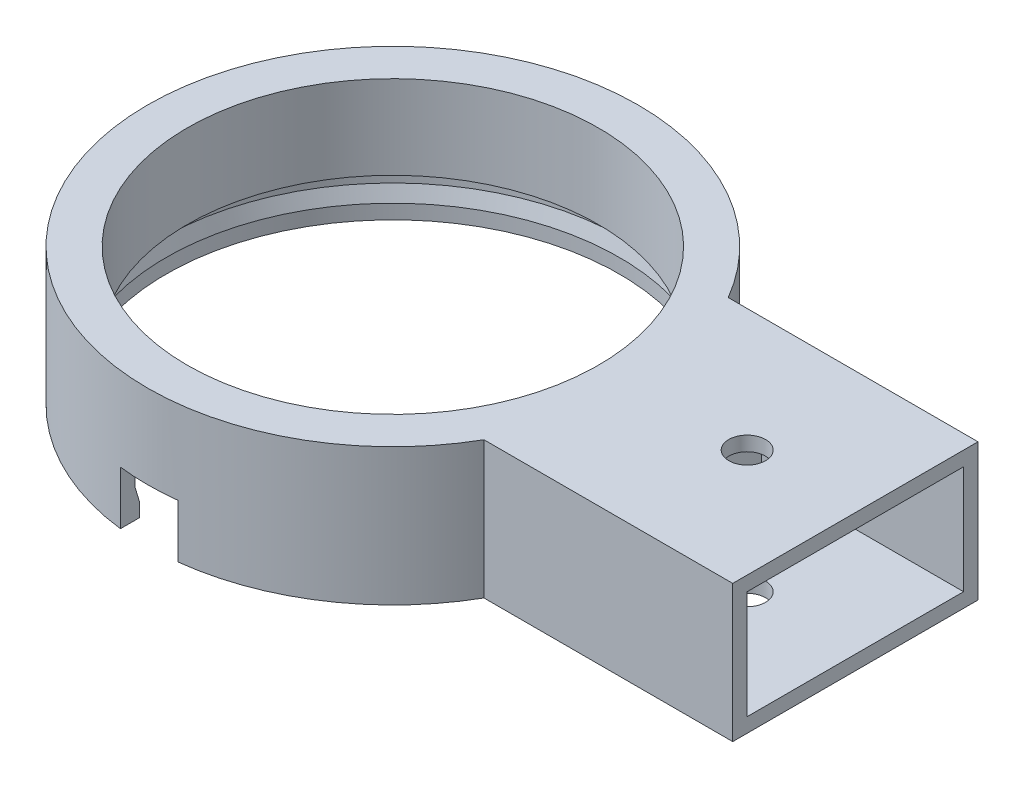
from build123d import *
from build123d.topology import SkipClean

# Parameters (mm, degrees)
SKETCH1_R                = 43.18
SKETCH1_R_2              = 38.1
SKETCH1_R_3              = 36.195
BOSS_EXTRUDE1_DEPTH      = 2.54
BOSS_EXTRUDE2_START      = 4.318
SKETCH2_R                = 43.18
SKETCH2_R_2              = 40.64
BOSS_EXTRUDE2_DEPTH      = 4.318
SKETCH7_W                = 5.08
SKETCH7_H                = 10.16
CUT_EXTRUDE1_DEPTH       = 12.7
SKETCH12_R               = 43.18
SKETCH12_R_2             = 36.195
BOSS_EXTRUDE3_DEPTH      = 12.192
BOSS_EXTRUDE4_REACH      = 99.671
BOSS_EXTRUDE4_END_RADIUS = 43.18
SKETCH13_W               = 43.18
SKETCH13_H               = 24.13
BOSS_EXTRUDE5_DEPTH      = 38.1
SKETCH14_W               = 38.1
SKETCH14_H               = 19.05
CUT_EXTRUDE2_DEPTH       = 35.56
SKETCH17_R               = 3.2385
CUT_EXTRUDE3_DEPTH       = 35.56


with BuildPart() as part:
    # Sketch1 → Boss-Extrude1 (new body)
    # profile 1 of 2: a face of its own
    with BuildSketch(Plane(origin=(0, 0, 0), x_dir=(1, 0, 0), z_dir=(0, 1, 0))):
        with Locations(Location((0, 0, 0), (0, 0, 270))):
            Circle(SKETCH1_R)
        Circle(SKETCH1_R_2, mode=Mode.SUBTRACT)
    # profile 2 of 2: a face of its own
    with BuildSketch(Plane(origin=(0, 0, 0), x_dir=(1, 0, 0), z_dir=(0, 1, 0))):
        Circle(SKETCH1_R_2)
        with Locations(Location((0, 0, 0), (0, 0, 270))):
            Circle(SKETCH1_R_3, mode=Mode.SUBTRACT)
    extrude(amount=BOSS_EXTRUDE1_DEPTH)

    # Sketch2 → Boss-Extrude2 (add)
    with BuildSketch(Plane.XZ.offset(BOSS_EXTRUDE2_START)):
        with Locations(Location((0, 0, 0), (0, 0, 270))):
            Circle(SKETCH2_R)
        with Locations(Location((0, 0, 0), (0, 0, 270))):
            Circle(SKETCH2_R_2, mode=Mode.SUBTRACT)
    extrude(amount=-BOSS_EXTRUDE2_DEPTH)

    # Sketch3 → Revolve1 (revolve)
    with BuildSketch(Plane.XY, mode=Mode.PRIVATE) as revolve1_sk:
        Polygon((-40.64, -4.318), (-43.18, -4.318), (-43.18, -9.398), (-39.878, -9.398), (-39.878, -6.858), align=None)
    revolve(revolve1_sk.sketch.rotate(Axis((0, 0, 0), (0, 1, 0)), 270), axis=Axis((0, 0, 0), (0, 1, 0)))

    # Sketch7 → Cut-Extrude1 (cut)
    with SkipClean():  # the faces are left unmerged after this step: merging them gives an invalid solid
        with BuildSketch(Plane.XY.offset(43.18)):
            with Locations((-2.54, -5.08)):
                Rectangle(SKETCH7_W, SKETCH7_H)
            with Locations((2.54, -5.08)):
                Rectangle(SKETCH7_W, SKETCH7_H)
        extrude(amount=-CUT_EXTRUDE1_DEPTH, mode=Mode.SUBTRACT)

    # Sketch12 → Boss-Extrude3 (add)
    with SkipClean():  # the faces are left unmerged after this step: merging them gives an invalid solid
        with BuildSketch(Plane(origin=(0, 2.54, 0), x_dir=(1, 0, 0), z_dir=(0, 1, 0))):
            with Locations(Location((0, 0, 0), (0, 0, 263.243672969))):
                Circle(SKETCH12_R)
            with Locations(Location((0, 0, 0), (0, 0, 270))):
                Circle(SKETCH12_R_2, mode=Mode.SUBTRACT)
        extrude(amount=BOSS_EXTRUDE3_DEPTH)

    # Boss-Extrude4: up to this cylinder (the profile starts outside it)
    with SkipClean():  # the faces are left unmerged after this step: merging them gives an invalid solid
        boss_extrude4_end = Plane(origin=(0, 2.667, 0), z_dir=(0, -1, 0)) * Cylinder(BOSS_EXTRUDE4_END_RADIUS, 286.702, mode=Mode.PRIVATE)
        # Sketch8 → Boss-Extrude4 (add, up to the surface)
        with BuildSketch(Plane(origin=(43.18, 0, 0), x_dir=(0, 0, -1), z_dir=(1, 0, 0)), mode=Mode.PRIVATE) as boss_extrude4_sk1:
            Polygon((0.14993237, -9.398), (21.73993237, -9.398), (21.73993237, 14.732), (-21.44006763, 14.732), (-21.44006763, -9.398), align=None)
        boss_extrude4_tool1 = extrude(boss_extrude4_sk1.sketch, amount=-BOSS_EXTRUDE4_REACH, mode=Mode.PRIVATE) - boss_extrude4_end
        add(boss_extrude4_tool1.solids().sort_by_distance((43.18, 2.667, -0.149932))[0])
        add(boss_extrude4_tool1.solids().sort_by_distance((43.18, 2.667, -0.149932))[1])

    # Sketch13 → Boss-Extrude5 (add)
    with SkipClean():  # the faces are left unmerged after this step: merging them gives an invalid solid
        with BuildSketch(Plane(origin=(43.18, 0, 0), x_dir=(0, 0, -1), z_dir=(1, 0, 0))):
            with Locations((0.14993237, 2.667)):
                Rectangle(SKETCH13_W, SKETCH13_H)
        extrude(amount=BOSS_EXTRUDE5_DEPTH)

    # Sketch14 → Cut-Extrude2 (cut)
    with SkipClean():  # the faces are left unmerged after this step: merging them gives an invalid solid
        with BuildSketch(Plane(origin=(81.28, 0, 0), x_dir=(0, 0, -1), z_dir=(1, 0, 0))):
            with Locations((0.14993237, 2.667)):
                Rectangle(SKETCH14_W, SKETCH14_H)
        extrude(amount=-CUT_EXTRUDE2_DEPTH, mode=Mode.SUBTRACT)

    # Sketch17 → Cut-Extrude3 (cut)
    with SkipClean():  # the faces are left unmerged after this step: merging them gives an invalid solid
        with BuildSketch(Plane(origin=(0, 14.732, 0), x_dir=(1, 0, 0), z_dir=(0, 1, 0))):
            with Locations(Location((62.23, 0.14993237, 0), (0, 0, 90))):
                Circle(SKETCH17_R)
        extrude(amount=-CUT_EXTRUDE3_DEPTH, mode=Mode.SUBTRACT)


solid = part.part
